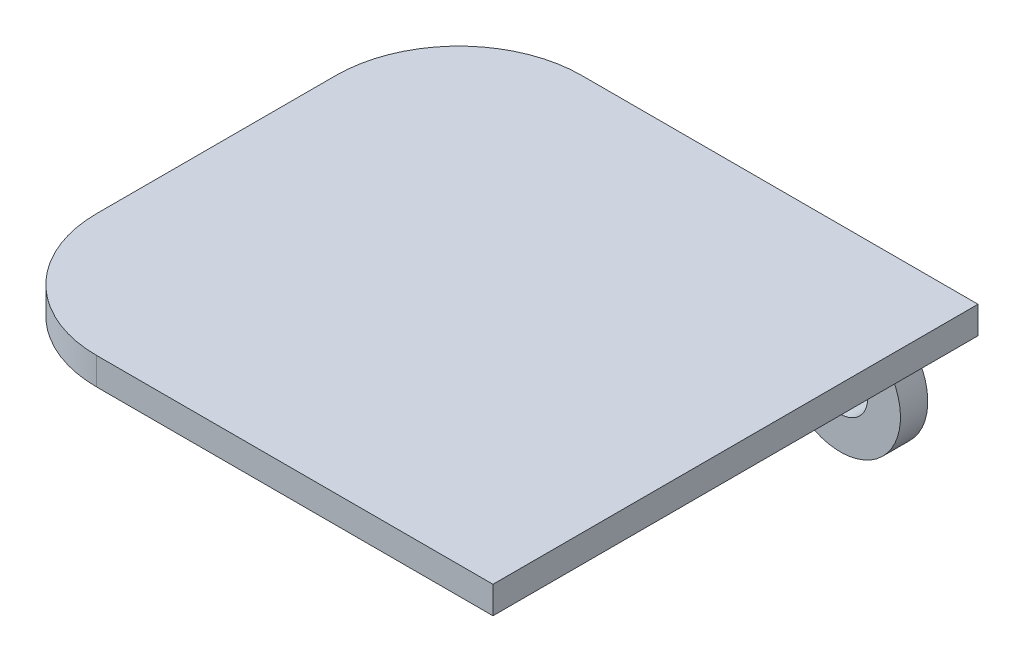
from build123d import *

# Parameters (mm, degrees)
BOSS_EXTRUDE1_DEPTH = 2
SKETCH2_R           = 2
BOSS_EXTRUDE2_DEPTH = 2


with BuildPart() as part:
    # Sketch1 → Boss-Extrude1 (new body)
    with BuildSketch(Plane(origin=(0, 0, 0), x_dir=(1, 0, 0), z_dir=(0, 1, 0))):
        with BuildLine():
            Line((-10, 17.75), (19, 17.75))
            Line((19, 17.75), (19, -17.75))
            Line((19, -17.75), (-10, -17.75))
            ThreePointArc((-10, -17.75), (-16.363961031, -15.113961031), (-19, -8.75))
            Line((-19, -8.75), (-19, 8.75))
            ThreePointArc((-19, 8.75), (-16.363961031, 15.113961031), (-10, 17.75))
        make_face()
    extrude(amount=BOSS_EXTRUDE1_DEPTH)

    # Sketch2 → Boss-Extrude2 (add)
    with BuildSketch(Plane(origin=(0, 0, -17.75), x_dir=(-1, 0, 0), z_dir=(0, 0, -1))):
        with BuildLine():
            Line((-10.5, 0), (-13.689709334, -2.577891806))
            ThreePointArc((-13.689709334, -2.577891806), (-14.346103242, -8.765714286), (-8.158280763, -9.422108194))
            Line((-8.158280763, -9.422108194), (3.5, 0))
            Line((3.5, 0), (-10.5, 0))
        make_face()
        with Locations((-10.923995048, -6)):
            Circle(SKETCH2_R, mode=Mode.SUBTRACT)
    extrude(amount=-BOSS_EXTRUDE2_DEPTH)


solid = part.part
